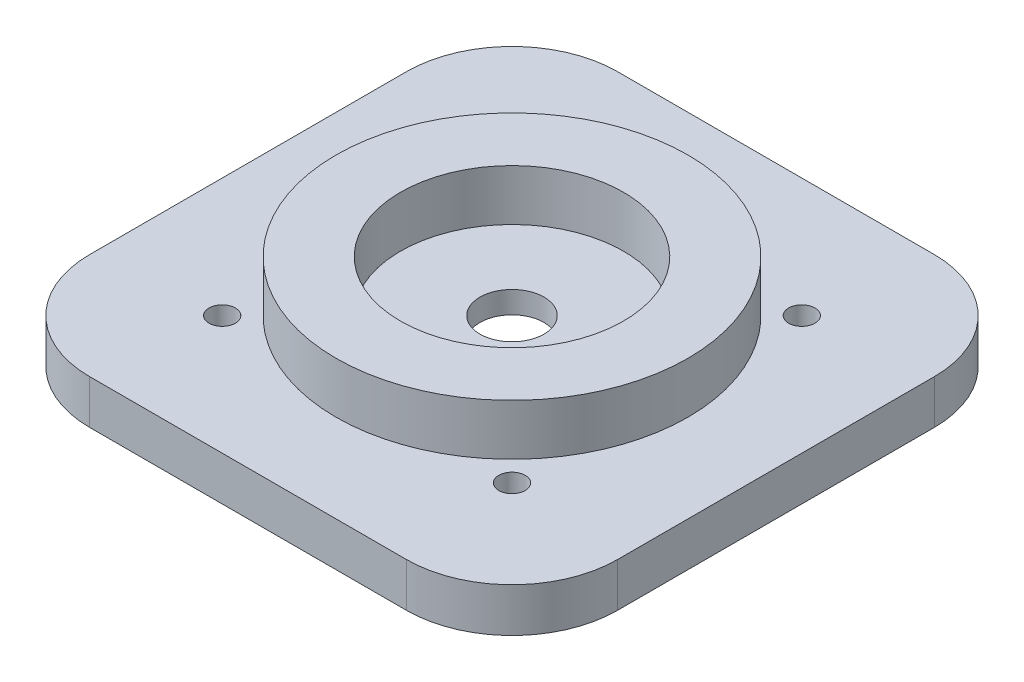
from build123d import *

# Parameters (mm, degrees)
SKETCH1_W           = 50.8
SKETCH1_H           = 50.8
SKETCH1_R           = 1.905
SKETCH1_R_2         = 4.625
BOSS_EXTRUDE1_DEPTH = 6.35
FILLET1_R           = 2.54
SKETCH4_R           = 1.905
CUT_EXTRUDE3_DEPTH  = 3.175
BOSS_EXTRUDE2_DEPTH = 6.35
SKETCH6_R           = 25.4
SKETCH6_R_2         = 16.1
BOSS_EXTRUDE3_DEPTH = 7.366


with BuildPart() as part:
    # Sketch1 → Boss-Extrude1 (new body)
    with BuildSketch(Plane(origin=(0, 0, 0), x_dir=(1, 0, 0), z_dir=(0, 1, 0))):
        with Locations((25.4, 25.4)):
            Rectangle(SKETCH1_W, SKETCH1_H)
        with Locations(Location((4.490128061, 46.309871939, 0), (0, 0, 270))):
            Circle(SKETCH1_R, mode=Mode.SUBTRACT)
        with Locations(Location((4.490128061, 4.490128061, 0), (0, 0, 270))):
            Circle(SKETCH1_R, mode=Mode.SUBTRACT)
        with Locations(Location((46.309871939, 4.490128061, 0), (0, 0, 270))):
            Circle(SKETCH1_R, mode=Mode.SUBTRACT)
        with Locations(Location((46.309871939, 46.309871939, 0), (0, 0, 270))):
            Circle(SKETCH1_R, mode=Mode.SUBTRACT)
        with Locations(Location((25.4, 25.4, 0), (0, 0, 270))):
            Circle(SKETCH1_R_2, mode=Mode.SUBTRACT)
    extrude(amount=BOSS_EXTRUDE1_DEPTH)

    # Fillet1
    fillet1_edges = [part.edges().sort_by_distance(p)[0] for p in [
        (50.8, 3.175, -50.8),
        (50.8, 3.175, 0),
        (0, 3.175, 0),
        (0, 3.175, -50.8),
    ]]
    fillet(fillet1_edges, radius=FILLET1_R)

    # Sketch4 → Cut-Extrude3 (cut)
    with BuildSketch(Plane.XZ):
        with Locations(Location((4.490128061, -4.490128061, 0), (0, 0, 90))):
            Circle(SKETCH4_R)
        with BuildLine():
            Line((10.205128061, -4.490128061), (40.594871939, -4.490128061))
            ThreePointArc((40.594871939, -4.490128061), (42.268756685, -8.531243315), (46.309871939, -10.205128061))
            Line((46.309871939, -10.205128061), (46.309871939, -40.594871939))
            ThreePointArc((46.309871939, -40.594871939), (42.268756685, -42.268756685), (40.594871939, -46.309871939))
            Line((40.594871939, -46.309871939), (10.205128061, -46.309871939))
            ThreePointArc((10.205128061, -46.309871939), (8.531243315, -42.268756685), (4.490128061, -40.594871939))
            Line((4.490128061, -40.594871939), (4.490128061, -10.205128061))
            ThreePointArc((4.490128061, -10.205128061), (8.531243315, -8.531243315), (10.205128061, -4.490128061))
        make_face()
    extrude(amount=-CUT_EXTRUDE3_DEPTH, mode=Mode.SUBTRACT)

    # Sketch5 → Boss-Extrude2 (add)
    with BuildSketch(Plane(origin=(0, 6.35, 0), x_dir=(1, 0, 0), z_dir=(0, 1, 0))):
        with BuildLine():
            Line((63.5, 2.54), (63.5, 48.26))
            ThreePointArc((63.5, 48.26), (59.036307345, 59.036307345), (48.26, 63.5))
            Line((48.26, 63.5), (2.54, 63.5))
            ThreePointArc((2.54, 63.5), (-8.236307345, 59.036307345), (-12.7, 48.26))
            Line((-12.7, 48.26), (-12.7, 2.54))
            ThreePointArc((-12.7, 2.54), (-8.236307345, -8.236307345), (2.54, -12.7))
            Line((2.54, -12.7), (48.26, -12.7))
            ThreePointArc((48.26, -12.7), (59.036307345, -8.236307345), (63.5, 2.54))
        make_face()
        with BuildLine():
            Line((50.8, 2.54), (50.8, 48.26))
            ThreePointArc((50.8, 48.26), (50.056051224, 50.056051224), (48.26, 50.8))
            Line((48.26, 50.8), (2.54, 50.8))
            ThreePointArc((2.54, 50.8), (0.743948776, 50.056051224), (0, 48.26))
            Line((0, 48.26), (0, 2.54))
            ThreePointArc((0, 2.54), (0.743948776, 0.743948776), (2.54, 0))
            Line((2.54, 0), (48.26, 0))
            ThreePointArc((48.26, 0), (50.056051224, 0.743948776), (50.8, 2.54))
        make_face(mode=Mode.SUBTRACT)
    extrude(amount=-BOSS_EXTRUDE2_DEPTH)

    # Sketch6 → Boss-Extrude3 (add)
    with BuildSketch(Plane(origin=(0, 6.35, 0), x_dir=(1, 0, 0), z_dir=(0, 1, 0))):
        with Locations(Location((25.4, 25.4, 0), (0, 0, 270))):
            Circle(SKETCH6_R)
        with Locations(Location((25.4, 25.4, 0), (0, 0, 270))):
            Circle(SKETCH6_R_2, mode=Mode.SUBTRACT)
    extrude(amount=BOSS_EXTRUDE3_DEPTH)


solid = part.part
